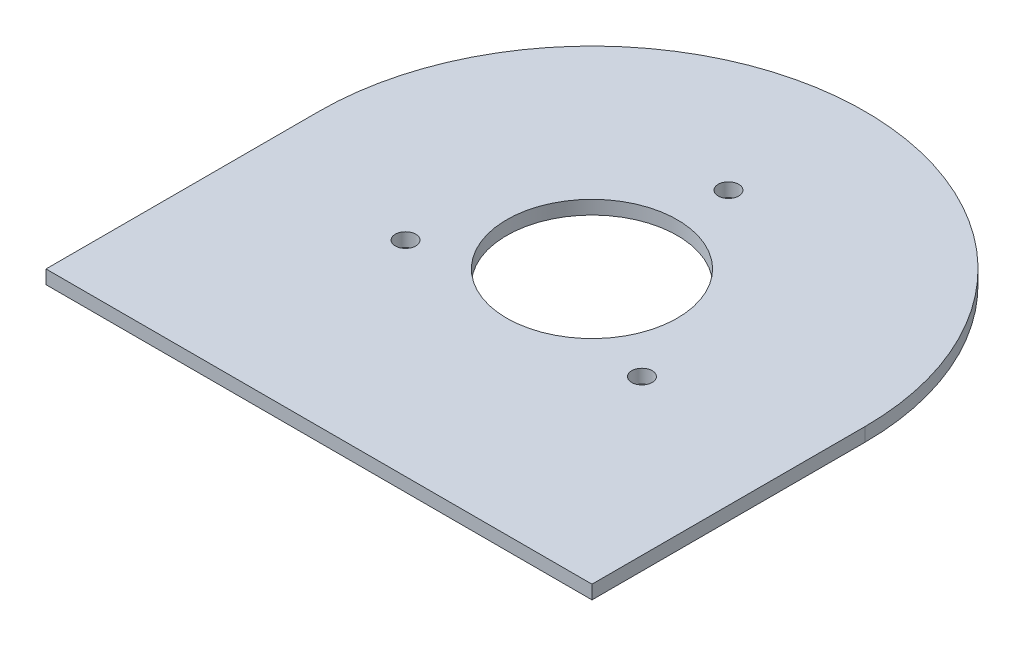
from build123d import *

# Parameters (mm, degrees)
SKETCH1_W           = 80
SKETCH1_H           = 80
BOSS_EXTRUDE1_DEPTH = 2
SKETCH3_R           = 12.5
CUT_EXTRUDE2_DEPTH  = 114.154761279
SKETCH5_R           = 1.5
CUT_EXTRUDE3_DEPTH  = 114.154761279
FILLET1_RADIUS      = 40
FILLET1_LENGTH      = 2


with BuildPart() as part:
    # Sketch1 → Boss-Extrude1 (new body)
    with BuildSketch(Plane(origin=(0, 0, 0), x_dir=(1, 0, 0), z_dir=(0, 1, 0))):
        with Locations((40, 40)):
            Rectangle(SKETCH1_W, SKETCH1_H)
    extrude(amount=BOSS_EXTRUDE1_DEPTH)

    # Sketch3 → Cut-Extrude2 (cut, through all)
    with BuildSketch(Plane(origin=(0, 2, 0), x_dir=(1, 0, 0), z_dir=(0, 1, 0))):
        with Locations(Location((40, 40, 0), (0, 0, 270))):
            Circle(SKETCH3_R)
    extrude(amount=-CUT_EXTRUDE2_DEPTH, mode=Mode.SUBTRACT)

    # Sketch5 → Cut-Extrude3 (cut, through all)
    with BuildSketch(Plane(origin=(0, 2, 0), x_dir=(1, 0, 0), z_dir=(0, 1, 0))):
        with Locations(Location((22.68, 30.000293338, 0), (0, 0, 270))):
            Circle(SKETCH5_R)
        with Locations(Location((57.32, 30.000293338, 0), (0, 0, 270))):
            Circle(SKETCH5_R)
        with Locations(Location((40, 59.999413325, 0), (0, 0, 270))):
            Circle(SKETCH5_R)
    extrude(amount=-CUT_EXTRUDE3_DEPTH, mode=Mode.SUBTRACT)

    # Fillet1: full round fillet: the end face becomes a half cylinder, R = half its width
    fillet1_face = Plane((40, 1, -80), x_dir=(0, 1, 0), z_dir=(0, 0, -1))  # on the end face: x along it, z out of the body
    fillet1_slab = fillet1_face.offset(-FILLET1_RADIUS / 2) * Box(FILLET1_LENGTH, 2 * FILLET1_RADIUS, FILLET1_RADIUS, mode=Mode.PRIVATE)  # the body's end, R deep
    fillet1_round = Plane((40, 1, -40), x_dir=(0, 0, -1), z_dir=(0, 1, 0)) * Cylinder(FILLET1_RADIUS, FILLET1_LENGTH, mode=Mode.PRIVATE)  # its axis R under the face
    add(fillet1_slab - fillet1_round, mode=Mode.SUBTRACT)


solid = part.part
